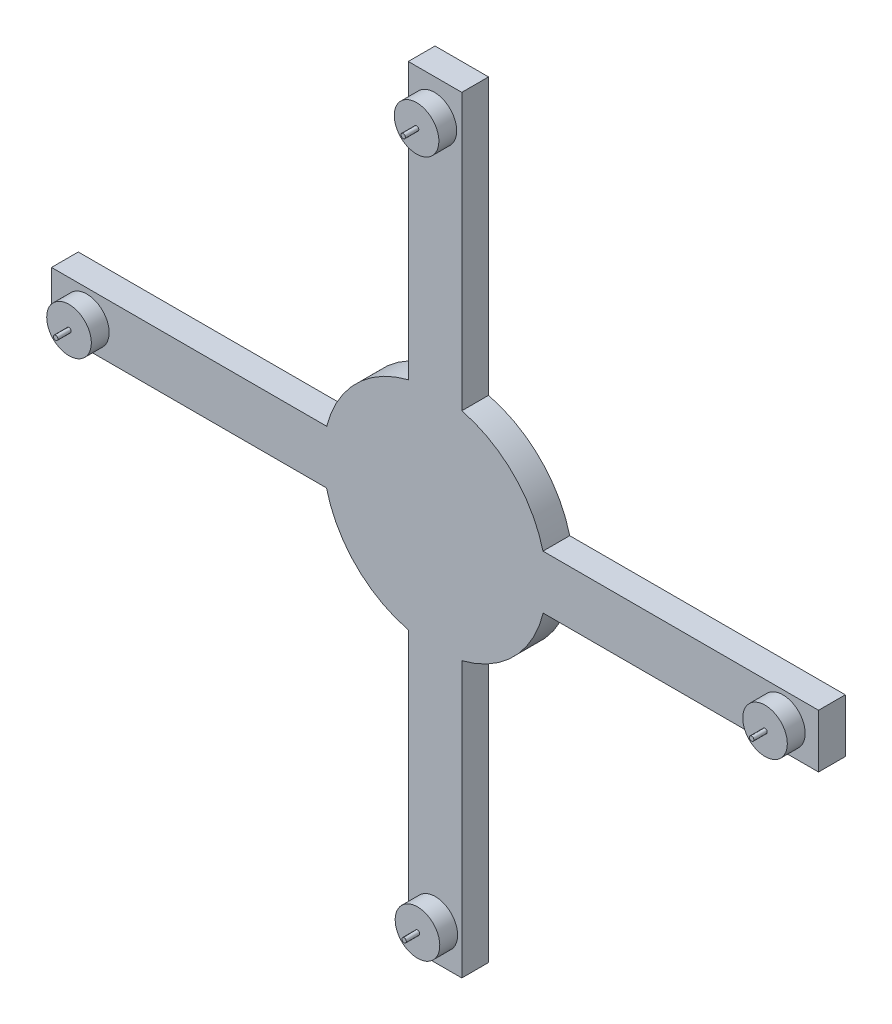
from build123d import *

# Parameters (mm, degrees)
BOSS_EXTRUDE1_DEPTH      = 15
BOSS_EXTRUDE1_DEPTH_BACK = 15
SKETCH2_R                = 25
BOSS_EXTRUDE2_DEPTH      = 20
SKETCH3_R                = 2.5
BOSS_EXTRUDE3_DEPTH      = 15
CIRPATTERN1_COUNT        = 4


with BuildPart() as part:
    # Sketch1 → Boss-Extrude1 (new, two sides: drawn at the far end of the back side and taken through both)
    with BuildSketch(Plane.XY.offset(-BOSS_EXTRUDE1_DEPTH_BACK)):
        with BuildLine():
            Line((30, 430), (-30, 430))
            Line((-30, 430), (-30, 120.881719036))
            ThreePointArc((-30, 120.881719036), (-88.332125518, 88.135628612), (-121.425810587, 30))
            Line((-121.425810587, 30), (-430, 30))
            Line((-430, 30), (-430, -30))
            Line((-430, -30), (-121.68100765, -30))
            ThreePointArc((-121.68100765, -30), (-88.7083861, -88.792246397), (-30, -121.91395242))
            Line((-30, -121.91395242), (-30, -430))
            Line((-30, -430), (30, -430))
            Line((30, -430), (30, -121.811124765))
            ThreePointArc((30, -121.811124765), (88.443617434, -88.640445466), (121.26508205, -30))
            Line((121.26508205, -30), (430, -30))
            Line((430, -30), (430, 30))
            Line((430, 30), (121.009884987, 30))
            ThreePointArc((121.009884987, 30), (88.068001132, 87.984471961), (30, 120.778891382))
            Line((30, 120.778891382), (30, 430))
        make_face()
    extrude(amount=BOSS_EXTRUDE1_DEPTH + BOSS_EXTRUDE1_DEPTH_BACK)

    # Sketch2 → Boss-Extrude2 (add)
    with BuildSketch(Plane.XY.offset(15)):
        with Locations((390, 0)):
            Circle(SKETCH2_R)
    boss_extrude2 = extrude(amount=BOSS_EXTRUDE2_DEPTH)

    # Sketch3 → Boss-Extrude3 (add)
    with BuildSketch(Plane.XY.offset(35)):
        with Locations((390, 0)):
            Circle(SKETCH3_R)
    boss_extrude3 = extrude(amount=BOSS_EXTRUDE3_DEPTH)

    # CirPattern1: Boss-Extrude2, Boss-Extrude3 ×4 about axis
    cirpattern1_axis = Axis((-0.2079628, -0.516116692, -15), (0, 0, 1))
    add([boss_extrude2.rotate(cirpattern1_axis, i * 360 / CIRPATTERN1_COUNT) for i in range(1, CIRPATTERN1_COUNT)])
    add([boss_extrude3.rotate(cirpattern1_axis, i * 360 / CIRPATTERN1_COUNT) for i in range(1, CIRPATTERN1_COUNT)])


solid = part.part
